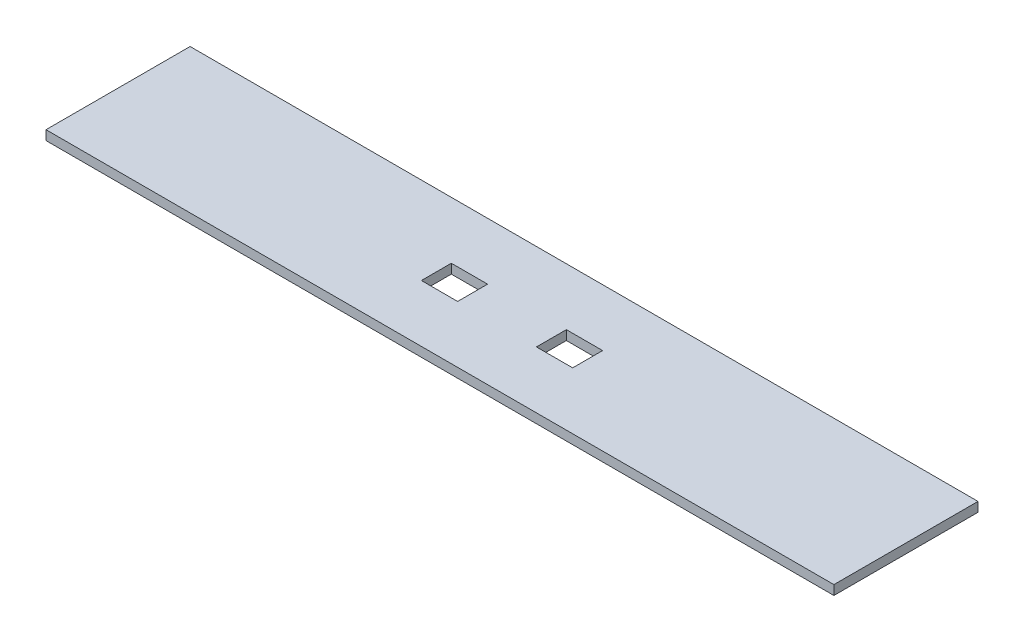
from build123d import *

# Parameters (mm, degrees)
SKETCH1_W               = 250
SKETCH1_H               = 45.72
BOSS_EXTRUDE1_DEPTH     = 3
CUT_EXTRUDE2_DEPTH      = 128.108534725
CUT_EXTRUDE2_DEPTH_BACK = 128.108534725
SKETCH2_W               = 11.500000066
SKETCH2_H               = 9.500000002
SKETCH2_H_2             = 9.50000005


with BuildPart() as part:
    # Sketch1 → Boss-Extrude1 (new body)
    with BuildSketch(Plane(origin=(0, 0, 0), x_dir=(1, 0, 0), z_dir=(0, 1, 0))):
        Rectangle(SKETCH1_W, SKETCH1_H)
    extrude(amount=BOSS_EXTRUDE1_DEPTH)

    # Sketch2 → Cut-Extrude2 (cut, two sides: drawn at the far end of the back side and taken through both)
    with BuildSketch(Plane(origin=(0, 0, 0), x_dir=(1, 0, 0), z_dir=(0, 1, 0)).offset(-CUT_EXTRUDE2_DEPTH_BACK)):
        with Locations((-18.250000033, 0)):
            Rectangle(SKETCH2_W, SKETCH2_H)
        with Locations((18.250000033, 0)):
            Rectangle(SKETCH2_W, SKETCH2_H_2)
    extrude(amount=CUT_EXTRUDE2_DEPTH + CUT_EXTRUDE2_DEPTH_BACK, mode=Mode.SUBTRACT)


solid = part.part
